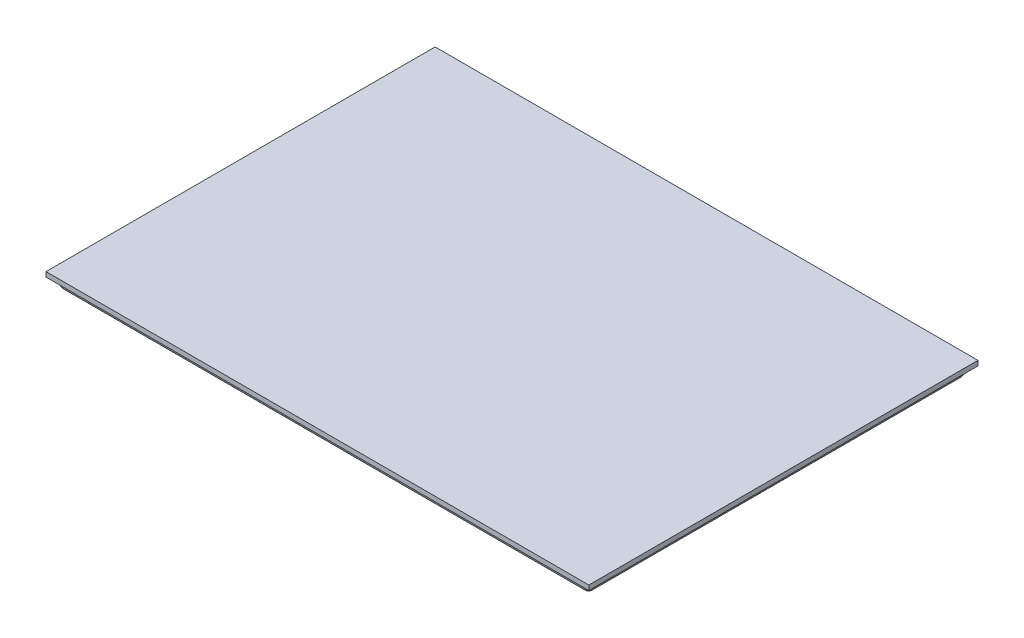
from build123d import *

# Parameters (mm, degrees)
SKETCH1_W           = 113
SKETCH1_H           = 81
BOSS_EXTRUDE1_DEPTH = 1
SKETCH2_W           = 110.7
SKETCH2_H           = 78.8
BOSS_EXTRUDE2_DEPTH = 2
FILLET3_R           = 1


with BuildPart() as part:
    # Sketch1 → Boss-Extrude1 (new body)
    with BuildSketch(Plane(origin=(0, 0, 0), x_dir=(1, 0, 0), z_dir=(0, 1, 0))):
        Rectangle(SKETCH1_W, SKETCH1_H)
    extrude(amount=BOSS_EXTRUDE1_DEPTH)

    # Sketch2 → Boss-Extrude2 (add)
    with BuildSketch(Plane.XZ):
        Rectangle(SKETCH2_W, SKETCH2_H)
    extrude(amount=BOSS_EXTRUDE2_DEPTH)

    # Fillet3
    fillet3_edges = [part.edges().sort_by_distance(p)[0] for p in [
        (55.35, -1, -39.4),
        (55.35, -1, 39.4),
        (-55.35, -1, 39.4),
        (-55.35, -1, -39.4),
        (55.35, -2, 0),
        (0, -2, 39.4),
        (-55.35, -2, 0),
        (0, -2, -39.4),
    ]]
    fillet(fillet3_edges, radius=FILLET3_R)


solid = part.part
